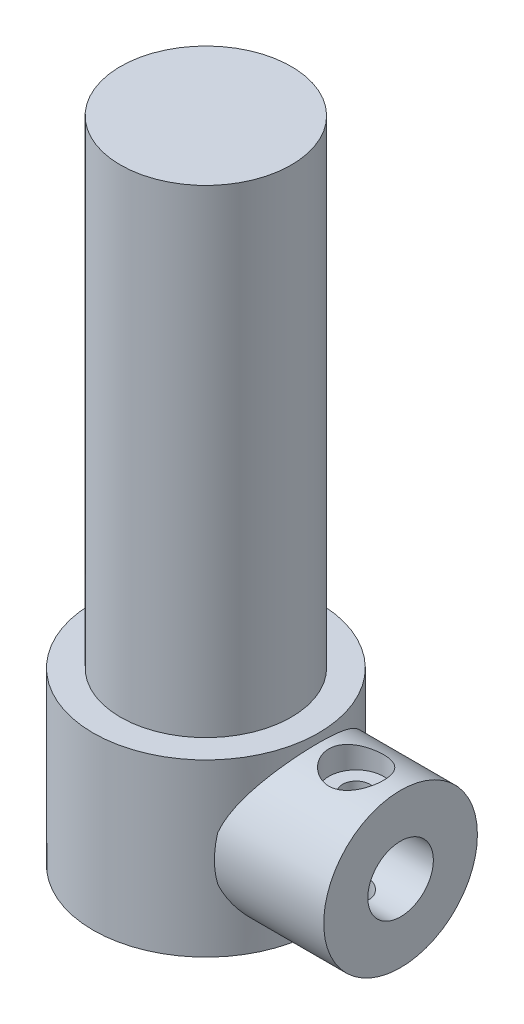
from build123d import *

# Parameters (mm, degrees)
ESQUISSE1_R                         = 16.5
BOSS_EXTRU_1_DEPTH                  = 25
BOSS_EXTRU_4_DEPTH                  = 12
BOSS_EXTRU_4_DEPTH_BACK             = 4
ESQUISSE9_R                         = 11.25
ESQUISSE10_R                        = 4.8
ENL_V_MAT_EXTRU_3_DEPTH             = 13
ESQUISSE11_R                        = 4
ENL_V_MAT_EXTRU_4_DEPTH             = 3.5
ENL_V_MAT_EXTRU_5_REACH             = 40.66
ENL_V_MAT_EXTRU_5_END_RADIUS        = 4.8
ESQUISSE12_R                        = 2
ESQUISSE13_R                        = 12.5
BOSS_EXTRU_5_DEPTH                  = 70
ESQUISSE15_R                        = 8
BOSS_EXTRU_6_DEPTH                  = 1.2
ESQUISSE2_R                         = 4.75
ENL_V_MAT_EXTRU_6_DEPTH             = 40
ENL_V_MAT_EXTRU_6_DIRECTION_2_REACH = 102.546


with BuildPart() as part:
    # Esquisse1 → Boss.-Extru.1 (new body)
    with BuildSketch(Plane(origin=(0, 0, 0), x_dir=(1, 0, 0), z_dir=(0, 1, 0))):
        with Locations(Location((0, 0, 0), (0, 0, 270))):
            Circle(ESQUISSE1_R)
    extrude(amount=BOSS_EXTRU_1_DEPTH)

    # Esquisse9 → Boss.-Extru.4 (add, two sides: drawn at the far end of the back side and taken through both)
    with BuildSketch(Plane(origin=(16.5, 0, 0), x_dir=(0, 0, -1), z_dir=(1, 0, 0)).offset(-BOSS_EXTRU_4_DEPTH_BACK)):
        with Locations((0, 12.5)):
            Circle(ESQUISSE9_R)
    extrude(amount=BOSS_EXTRU_4_DEPTH + BOSS_EXTRU_4_DEPTH_BACK)

    # Esquisse10 → Enlèv. mat.-Extru.3 (cut)
    with BuildSketch(Plane(origin=(28.5, 0, 0), x_dir=(0, 0, -1), z_dir=(1, 0, 0))):
        with Locations((0, 12.5)):
            Circle(ESQUISSE10_R)
    extrude(amount=-ENL_V_MAT_EXTRU_3_DEPTH, mode=Mode.SUBTRACT)

    # Esquisse11 → Enlèv. mat.-Extru.4 (cut)
    with BuildSketch(Plane(origin=(0, 1.25, 0), x_dir=(1, 0, 0), z_dir=(0, 1, 0))):
        with Locations(Location((22, 0, 0), (0, 0, 90))):
            Circle(ESQUISSE11_R)
    enl_v_mat_extru_4 = extrude(amount=ENL_V_MAT_EXTRU_4_DEPTH, mode=Mode.SUBTRACT)

    # Enlèv. mat.-Extru.5: up to this cylinder (the profile starts outside it)
    enl_v_mat_extru_5_end = Plane(origin=(22, 12.5, 0), z_dir=(1, 0, 0)) * Cylinder(ENL_V_MAT_EXTRU_5_END_RADIUS, 91.92, mode=Mode.PRIVATE)
    # Esquisse12 → Enlèv. mat.-Extru.5 (cut, up to the surface)
    with BuildSketch(Plane.XZ.offset(-4.75), mode=Mode.PRIVATE) as enl_v_mat_extru_5_sk1:
        with Locations(Location((22, 0, 0), (0, 0, 270))):
            Circle(ESQUISSE12_R)
    enl_v_mat_extru_5_tool1 = extrude(enl_v_mat_extru_5_sk1.sketch, amount=-ENL_V_MAT_EXTRU_5_REACH, mode=Mode.PRIVATE) - enl_v_mat_extru_5_end
    enl_v_mat_extru_5 = enl_v_mat_extru_5_tool1.solids().sort_by_distance((22, 4.75, 0))[0]
    add(enl_v_mat_extru_5, mode=Mode.SUBTRACT)

    # Symétrie1: Enlèv. mat.-Extru.4, Enlèv. mat.-Extru.5 across plane
    add(enl_v_mat_extru_4.mirror(Plane.XY), mode=Mode.SUBTRACT)
    add(enl_v_mat_extru_5.mirror(Plane.XY), mode=Mode.SUBTRACT)

    # Symétrie1 at the second plane: Enlèv. mat.-Extru.4, Enlèv. mat.-Extru.5 across plane
    add(enl_v_mat_extru_4.mirror(Plane.ZX.offset(12.5)), mode=Mode.SUBTRACT)
    add(enl_v_mat_extru_5.mirror(Plane.ZX.offset(12.5)), mode=Mode.SUBTRACT)

    # Esquisse13 → Boss.-Extru.5 (add)
    with BuildSketch(Plane(origin=(0, 25, 0), x_dir=(1, 0, 0), z_dir=(0, 1, 0))):
        with Locations(Location((0, 0, 0), (0, 0, 270))):
            Circle(ESQUISSE13_R)
    extrude(amount=BOSS_EXTRU_5_DEPTH)

    # Esquisse15 → Boss.-Extru.6 (add)
    with BuildSketch(Plane.XZ):
        with Locations(Location((0, 0, 0), (0, 0, 270))):
            Circle(ESQUISSE15_R)
    extrude(amount=BOSS_EXTRU_6_DEPTH)

    # Esquisse2 → Enlèv. mat.-Extru.6 (cut)
    with BuildSketch(Plane.XZ):
        with Locations(Location((0, 0, 0), (0, 0, 270))):
            Circle(ESQUISSE2_R)
    extrude(amount=-ENL_V_MAT_EXTRU_6_DEPTH, mode=Mode.SUBTRACT)

    # Esquisse2 → Enlèv. mat.-Extru.6 direction 2 (cut, up to next)
    with BuildSketch(Plane.XZ, mode=Mode.PRIVATE) as enl_v_mat_extru_6_direction_2_sk1:
        with Locations(Location((0, 0, 0), (0, 0, 270))):
            Circle(ESQUISSE2_R)
    enl_v_mat_extru_6_direction_2_tool1 = extrude(enl_v_mat_extru_6_direction_2_sk1.sketch, amount=ENL_V_MAT_EXTRU_6_DIRECTION_2_REACH, mode=Mode.PRIVATE) & part.part
    add(enl_v_mat_extru_6_direction_2_tool1.solids().sort_by_distance((0, 0, 0))[0], mode=Mode.SUBTRACT)


solid = part.part
